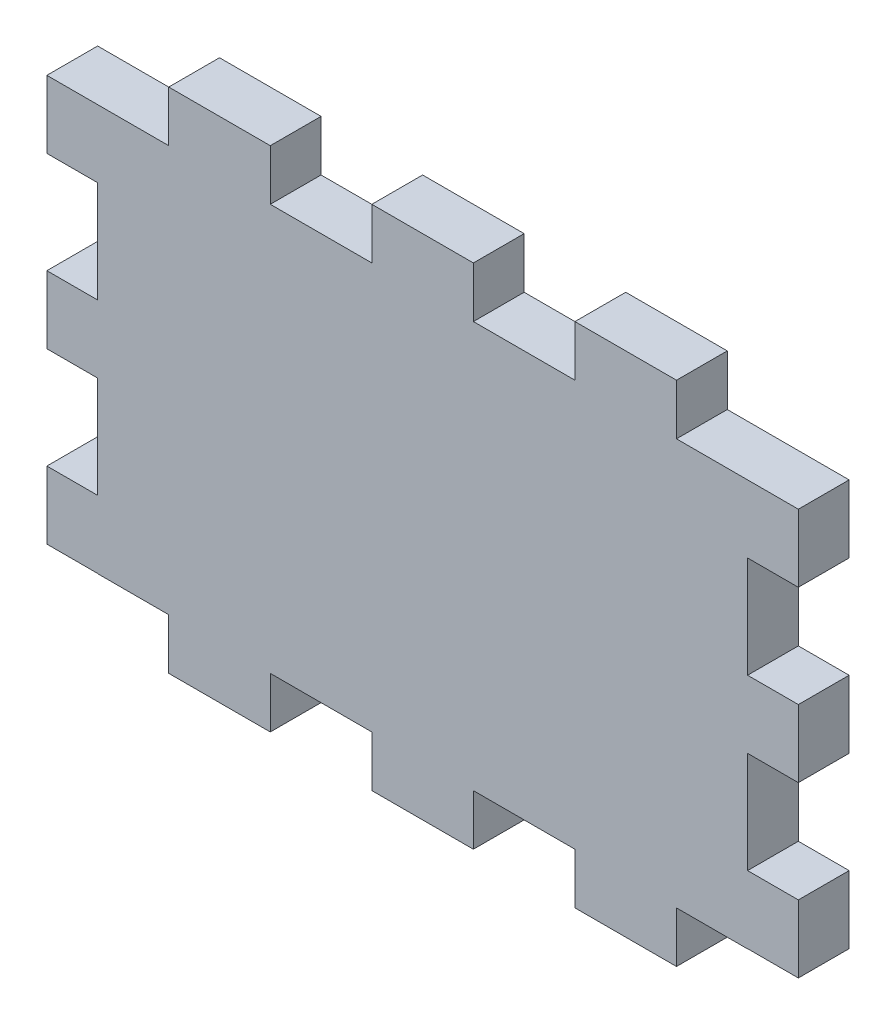
from build123d import *

# Parameters (mm, degrees)
BOSS_EXTRUDE1_DEPTH = 2.5


with BuildPart() as part:
    # Sketch1 → Boss-Extrude1 (new body)
    with BuildSketch(Plane.XY):
        Polygon((2.5, -12.5), (2.5, -10), (7.5, -10), (7.5, -12.5), (12.5, -12.5), (12.5, -10), (16, -10), (16, -9.99), (18.5, -9.99), (18.5, -6.66), (16, -6.66), (16, -1.66), (18.5, -1.66), (18.5, 1.67), (16, 1.67), (16, 6.67), (18.5, 6.67), (18.5, 10), (12.5, 10), (12.5, 12.5), (7.5, 12.5), (7.5, 10), (2.5, 10), (2.5, 12.5), (-2.5, 12.5), (-2.5, 10), (-7.5, 10), (-7.5, 12.5), (-12.5, 12.5), (-12.5, 10), (-18.5, 10), (-18.5, 6.67), (-16, 6.67), (-16, 1.67), (-18.5, 1.67), (-18.5, -1.66), (-16, -1.66), (-16, -6.66), (-18.5, -6.66), (-18.5, -9.99), (-16, -9.99), (-16, -10), (-12.5, -10), (-12.5, -12.5), (-7.5, -12.5), (-7.5, -10), (-2.5, -10), (-2.5, -12.5), align=None)
    extrude(amount=BOSS_EXTRUDE1_DEPTH)


solid = part.part
